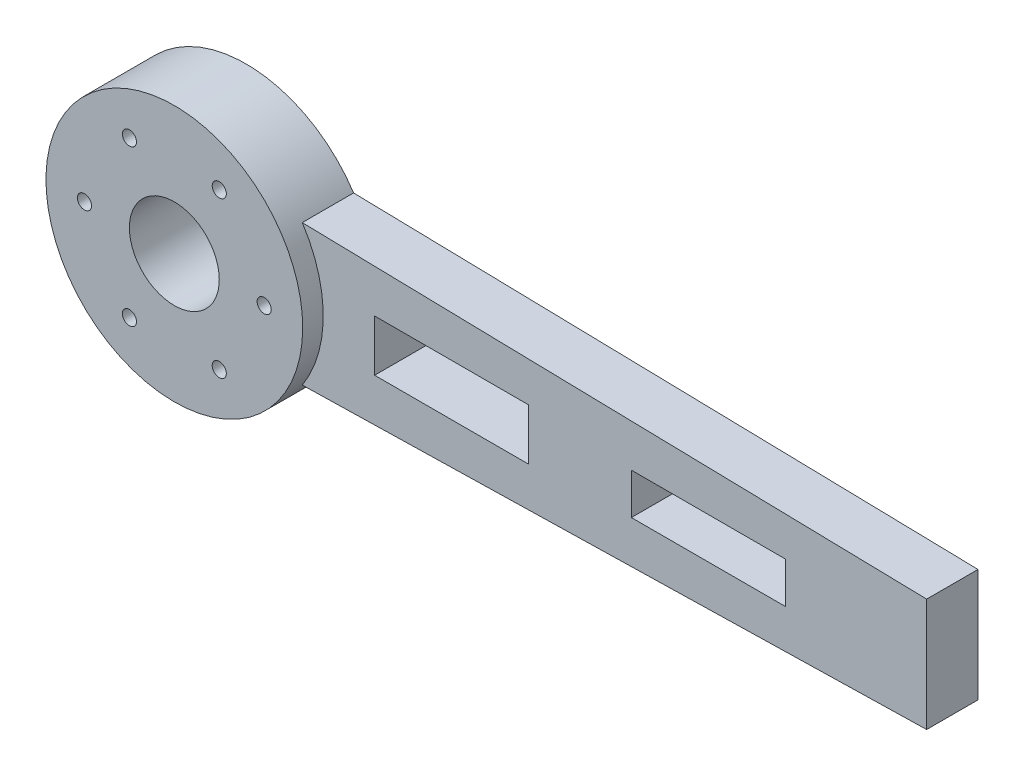
from build123d import *

# Parameters (mm, degrees)
SKETCH1_R           = 50
SKETCH1_R_2         = 17.5
SKETCH1_R_3         = 2.75
BOSS_EXTRUDE1_DEPTH = 28
SKETCH3_W           = 60
SKETCH3_H           = 20
SKETCH3_H_2         = 16
BOSS_EXTRUDE3_DEPTH = 20


with BuildPart() as part:
    # Sketch1 → Boss-Extrude1 (new body)
    with BuildSketch(Plane.XY):
        Circle(SKETCH1_R)
        Circle(SKETCH1_R_2, mode=Mode.SUBTRACT)
        with Locations((35, 0)):
            Circle(SKETCH1_R_3, mode=Mode.SUBTRACT)
        with Locations((17.5, 30.310889132)):
            Circle(SKETCH1_R_3, mode=Mode.SUBTRACT)
        with Locations((-17.5, 30.310889132)):
            Circle(SKETCH1_R_3, mode=Mode.SUBTRACT)
        with Locations((-35, 0)):
            Circle(SKETCH1_R_3, mode=Mode.SUBTRACT)
        with Locations((-17.5, -30.310889132)):
            Circle(SKETCH1_R_3, mode=Mode.SUBTRACT)
        with Locations((17.5, -30.310889132)):
            Circle(SKETCH1_R_3, mode=Mode.SUBTRACT)
    extrude(amount=BOSS_EXTRUDE1_DEPTH)

    # Sketch3 → Boss-Extrude3 (add)
    with BuildSketch(Plane.XY):
        Polygon((15, -28), (15, 28), (285, 22), (285, -22), align=None)
        with Locations((100, 0)):
            Rectangle(SKETCH3_W, SKETCH3_H, mode=Mode.SUBTRACT)
        with Locations((200, 0)):
            Rectangle(SKETCH3_W, SKETCH3_H_2, mode=Mode.SUBTRACT)
    extrude(amount=BOSS_EXTRUDE3_DEPTH)


solid = part.part
